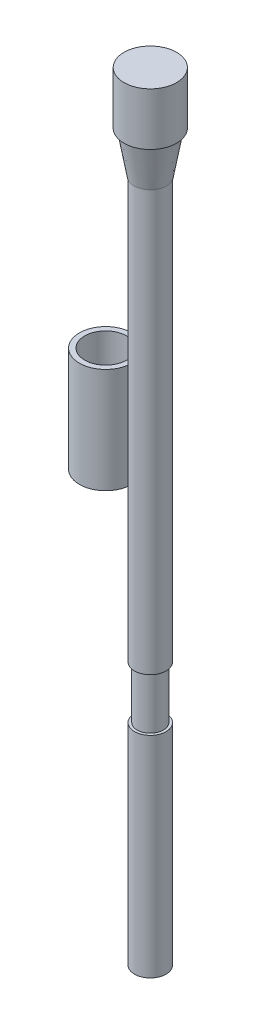
from build123d import *

# Parameters (mm, degrees)
SKETCH1_R           = 25
BOSS_EXTRUDE2_DEPTH = 50
SKETCH3_R           = 22.5
BOSS_EXTRUDE4_DEPTH = 40
BOSS_EXTRUDE4_TAPER = 10
SKETCH5_R           = 15
BOSS_EXTRUDE5_DEPTH = 400
SKETCH7_R           = 25
BOSS_EXTRUDE6_DEPTH = 100
SKETCH8_R           = 20
CUT_EXTRUDE1_DEPTH  = 100
SKETCH10_R          = 12.5
BOSS_EXTRUDE7_DEPTH = 50
SKETCH11_R          = 15
BOSS_EXTRUDE8_DEPTH = 200


with BuildPart() as part:
    # Sketch1 → Boss-Extrude2 (new body)
    with BuildSketch(Plane(origin=(0, 0, 0), x_dir=(1, 0, 0), z_dir=(0, 1, 0))):
        with Locations(Location((0, 0, 0), (0, 0, 270))):
            Circle(SKETCH1_R)
    extrude(amount=BOSS_EXTRUDE2_DEPTH)

    # Sketch3 → Boss-Extrude4 (add)
    with BuildSketch(Plane.XZ):
        Circle(SKETCH3_R)
    extrude(amount=BOSS_EXTRUDE4_DEPTH, taper=BOSS_EXTRUDE4_TAPER)

    # Sketch5 → Boss-Extrude5 (add)
    with BuildSketch(Plane.XZ.offset(40)):
        with Locations(Location((0, 0, 0), (0, 0, 270))):
            Circle(SKETCH5_R)
    extrude(amount=BOSS_EXTRUDE5_DEPTH)

    # Sketch10 → Boss-Extrude7 (add)
    with BuildSketch(Plane.XZ.offset(440)):
        with Locations(Location((0, 0, 0), (0, 0, 270))):
            Circle(SKETCH10_R)
    extrude(amount=BOSS_EXTRUDE7_DEPTH)

    # Sketch11 → Boss-Extrude8 (add)
    with BuildSketch(Plane.XZ.offset(490)):
        with Locations(Location((0, 0, 0), (0, 0, 270))):
            Circle(SKETCH11_R)
    extrude(amount=BOSS_EXTRUDE8_DEPTH)


with BuildPart() as body_2:
    # Sketch7 → Boss-Extrude6 (new body)
    with BuildSketch(Plane(origin=(0, -300, 0), x_dir=(1, 0, 0), z_dir=(0, 1, 0))):
        with Locations(Location((-39.963624291, -2.523145335, 0), (0, 0, 270))):
            Circle(SKETCH7_R)
    extrude(amount=BOSS_EXTRUDE6_DEPTH)

    # Sketch8 → Cut-Extrude1 (cut)
    with BuildSketch(Plane(origin=(0, -200, 0), x_dir=(1, 0, 0), z_dir=(0, 1, 0))):
        with Locations(Location((-39.963624291, -2.523145335, 0), (0, 0, 270))):
            Circle(SKETCH8_R)
    extrude(amount=-CUT_EXTRUDE1_DEPTH, mode=Mode.SUBTRACT)


solid = Compound([part.part, body_2.part])
